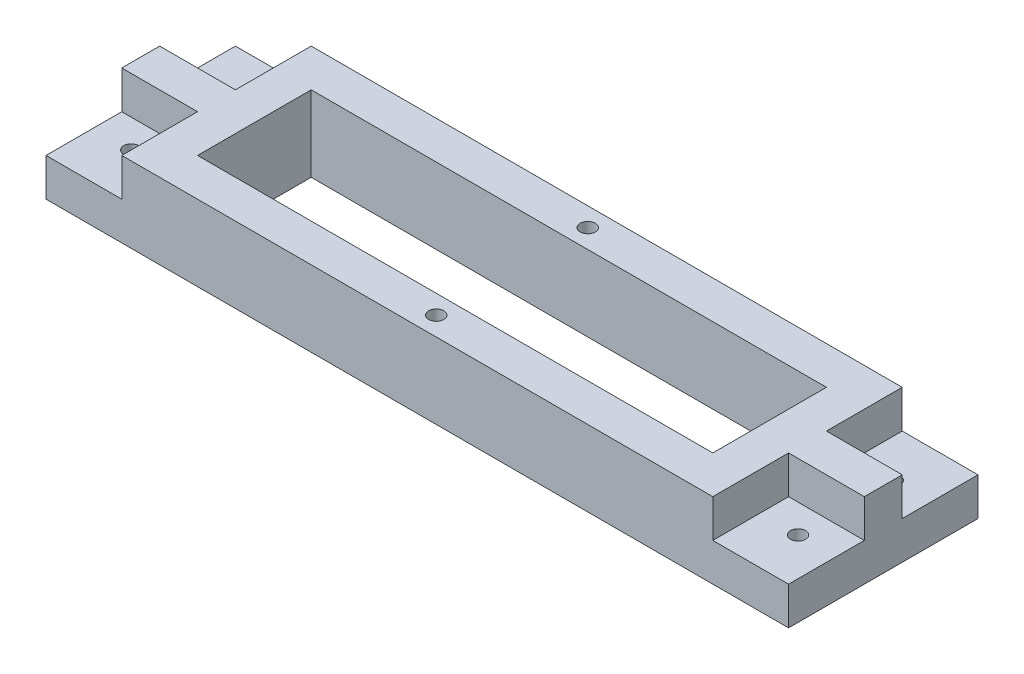
from build123d import *

# Parameters (mm, degrees)
SKETCH1_W           = 78
SKETCH1_H           = 25
BOSS_EXTRUDE1_DEPTH = 10
SKETCH2_W           = 68
SKETCH2_H           = 15
CUT_EXTRUDE2_DEPTH  = 10
SKETCH3_W           = 25
SKETCH3_H           = 5
BOSS_EXTRUDE2_DEPTH = 10
SKETCH4_W           = 25
SKETCH4_H           = 5
BOSS_EXTRUDE3_DEPTH = 10
SKETCH6_W           = 10
SKETCH6_H           = 5
BOSS_EXTRUDE4_DEPTH = 5
SKETCH9_R           = 1.75
CUT_EXTRUDE5_DEPTH  = 2
SKETCH10_R          = 1
CUT_EXTRUDE6_DEPTH  = 13
CUT_EXTRUDE7_DEPTH  = 1.5
SKETCH12_R          = 1
CUT_EXTRUDE8_DEPTH  = 10.5
SKETCH13_R          = 1
CUT_EXTRUDE9_DEPTH  = 15
SKETCH14_R          = 1.75
CUT_EXTRUDE11_DEPTH = 1.5


with BuildPart() as part:
    # Sketch1 → Boss-Extrude1 (new body)
    with BuildSketch(Plane(origin=(0, 0, 0), x_dir=(1, 0, 0), z_dir=(0, 1, 0))):
        Rectangle(SKETCH1_W, SKETCH1_H)
    extrude(amount=BOSS_EXTRUDE1_DEPTH)

    # Sketch2 → Cut-Extrude2 (cut)
    with BuildSketch(Plane(origin=(0, 10, 0), x_dir=(1, 0, 0), z_dir=(0, 1, 0))):
        Rectangle(SKETCH2_W, SKETCH2_H)
    extrude(amount=-CUT_EXTRUDE2_DEPTH, mode=Mode.SUBTRACT)

    # Sketch3 → Boss-Extrude2 (add)
    with BuildSketch(Plane.ZY.offset(39)):
        with Locations((0, 2.5)):
            Rectangle(SKETCH3_W, SKETCH3_H)
    extrude(amount=BOSS_EXTRUDE2_DEPTH)

    # Sketch4 → Boss-Extrude3 (add)
    with BuildSketch(Plane(origin=(39, 0, 0), x_dir=(0, 0, -1), z_dir=(1, 0, 0))):
        with Locations((0, 2.5)):
            Rectangle(SKETCH4_W, SKETCH4_H)
    extrude(amount=BOSS_EXTRUDE3_DEPTH)

    # Sketch6 → Boss-Extrude4 (add)
    with BuildSketch(Plane(origin=(0, 5, 0), x_dir=(1, 0, 0), z_dir=(0, 1, 0))):
        with Locations((44, 0)):
            Rectangle(SKETCH6_W, SKETCH6_H)
        with Locations((-44, 0)):
            Rectangle(SKETCH6_W, SKETCH6_H)
    extrude(amount=BOSS_EXTRUDE4_DEPTH)

    # Sketch9 → Cut-Extrude5 (cut)
    with BuildSketch(Plane.XZ):
        with Locations(Location((-44, 6.25, 0), (0, 0, 270))):
            Circle(SKETCH9_R)
        with Locations(Location((-44, -6.25, 0), (0, 0, 270))):
            Circle(SKETCH9_R)
        with Locations(Location((44, 6.25, 0), (0, 0, 270))):
            Circle(SKETCH9_R)
        with Locations(Location((44, -6.25, 0), (0, 0, 270))):
            Circle(SKETCH9_R)
    extrude(amount=-CUT_EXTRUDE5_DEPTH, mode=Mode.SUBTRACT)

    # Sketch10 → Cut-Extrude6 (cut)
    with BuildSketch(Plane.XZ.offset(-2)):
        with Locations(Location((-44, 6.25, 0), (0, 0, 270))):
            Circle(SKETCH10_R)
        with Locations(Location((-44, -6.25, 0), (0, 0, 270))):
            Circle(SKETCH10_R)
        with Locations(Location((44, 6.25, 0), (0, 0, 270))):
            Circle(SKETCH10_R)
        with Locations(Location((44, -6.25, 0), (0, 0, 270))):
            Circle(SKETCH10_R)
    extrude(amount=-CUT_EXTRUDE6_DEPTH, mode=Mode.SUBTRACT)

    # Sketch11 → Cut-Extrude7 (cut)
    with BuildSketch(Plane.XZ):
        with BuildLine():
            ThreePointArc((0, 11.75), (-1.75, 10), (0, 8.25))
            Line((0, 8.25), (0, 11.75))
        make_face()
        with BuildLine():
            Line((0, 11.75), (0, 8.25))
            ThreePointArc((0, 8.25), (1.237436867, 8.762563133), (1.75, 10))
            ThreePointArc((1.75, 10), (1.237436867, 11.237436867), (0, 11.75))
        make_face()
    extrude(amount=-CUT_EXTRUDE7_DEPTH, mode=Mode.SUBTRACT)

    # Sketch12 → Cut-Extrude8 (cut)
    with BuildSketch(Plane.XZ.offset(-1.5)):
        with Locations(Location((0, 10, 0), (0, 0, 270))):
            Circle(SKETCH12_R)
    extrude(amount=-CUT_EXTRUDE8_DEPTH, mode=Mode.SUBTRACT)

    # Sketch13 → Cut-Extrude9 (cut)
    with BuildSketch(Plane.XZ):
        with Locations(Location((0, -10, 0), (0, 0, 270))):
            Circle(SKETCH13_R)
    extrude(amount=-CUT_EXTRUDE9_DEPTH, mode=Mode.SUBTRACT)

    # Sketch14 → Cut-Extrude11 (cut)
    with BuildSketch(Plane.XZ):
        with Locations(Location((0, -10, 0), (0, 0, 270))):
            Circle(SKETCH14_R)
    extrude(amount=-CUT_EXTRUDE11_DEPTH, mode=Mode.SUBTRACT)


solid = part.part
